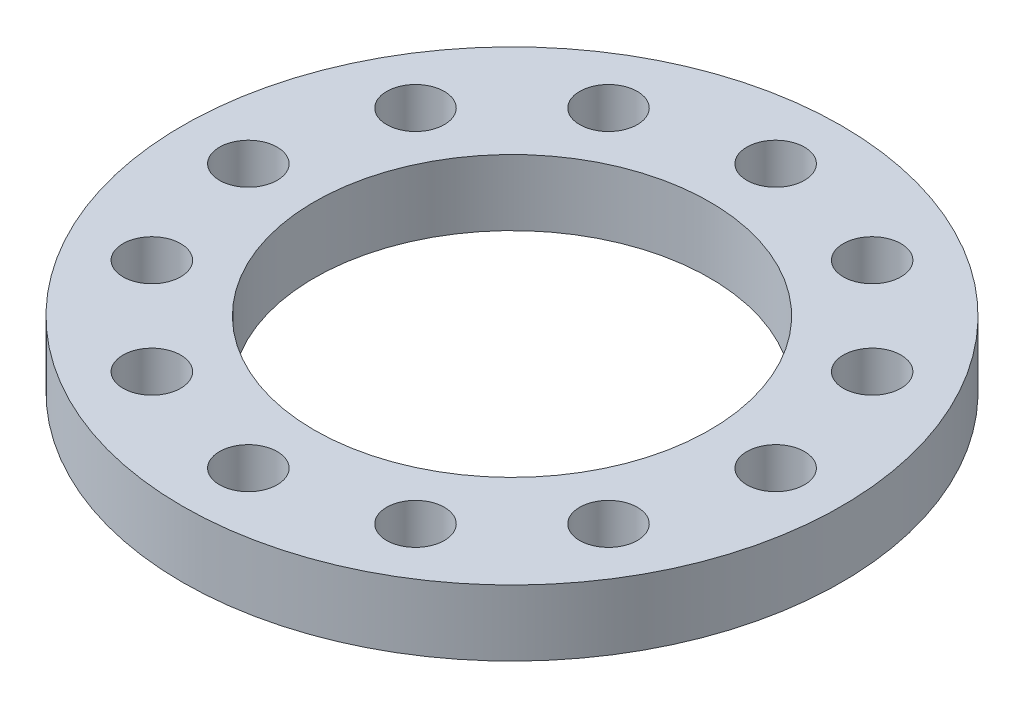
from build123d import *

# Parameters (mm, degrees)
ESBO_O1_R                = 20
ESBO_O1_R_2              = 1.75
ESBO_O1_R_3              = 12
RESSALTO_EXTRUS_O1_DEPTH = 4


with BuildPart() as part:
    # Esboço1 → Ressalto-extrusão1 (new body)
    with BuildSketch(Plane(origin=(0, 0, 0), x_dir=(1, 0, 0), z_dir=(0, 1, 0))):
        with Locations(Location((0, 0, 0), (0, 0, 270))):
            Circle(ESBO_O1_R)
        with Locations(Location((0, 16, 0), (0, 0, 270))):
            Circle(ESBO_O1_R_2, mode=Mode.SUBTRACT)
        with Locations(Location((8, 13.856406461, 0), (0, 0, 270))):
            Circle(ESBO_O1_R_2, mode=Mode.SUBTRACT)
        with Locations(Location((13.856406461, 8, 0), (0, 0, 270))):
            Circle(ESBO_O1_R_2, mode=Mode.SUBTRACT)
        with Locations(Location((16, 0, 0), (0, 0, 270))):
            Circle(ESBO_O1_R_2, mode=Mode.SUBTRACT)
        with Locations(Location((13.856406461, -8, 0), (0, 0, 270))):
            Circle(ESBO_O1_R_2, mode=Mode.SUBTRACT)
        with Locations(Location((0, -16, 0), (0, 0, 270))):
            Circle(ESBO_O1_R_2, mode=Mode.SUBTRACT)
        with Locations(Location((8, -13.856406461, 0), (0, 0, 270))):
            Circle(ESBO_O1_R_2, mode=Mode.SUBTRACT)
        with Locations(Location((-8, -13.856406461, 0), (0, 0, 270))):
            Circle(ESBO_O1_R_2, mode=Mode.SUBTRACT)
        with Locations(Location((-13.856406461, -8, 0), (0, 0, 270))):
            Circle(ESBO_O1_R_2, mode=Mode.SUBTRACT)
        with Locations(Location((-16, 0, 0), (0, 0, 270))):
            Circle(ESBO_O1_R_2, mode=Mode.SUBTRACT)
        with Locations(Location((-13.856406461, 8, 0), (0, 0, 270))):
            Circle(ESBO_O1_R_2, mode=Mode.SUBTRACT)
        with Locations(Location((-8, 13.856406461, 0), (0, 0, 270))):
            Circle(ESBO_O1_R_2, mode=Mode.SUBTRACT)
        with Locations(Location((0, 0, 0), (0, 0, 270))):
            Circle(ESBO_O1_R_3, mode=Mode.SUBTRACT)
    extrude(amount=RESSALTO_EXTRUS_O1_DEPTH)


solid = part.part
